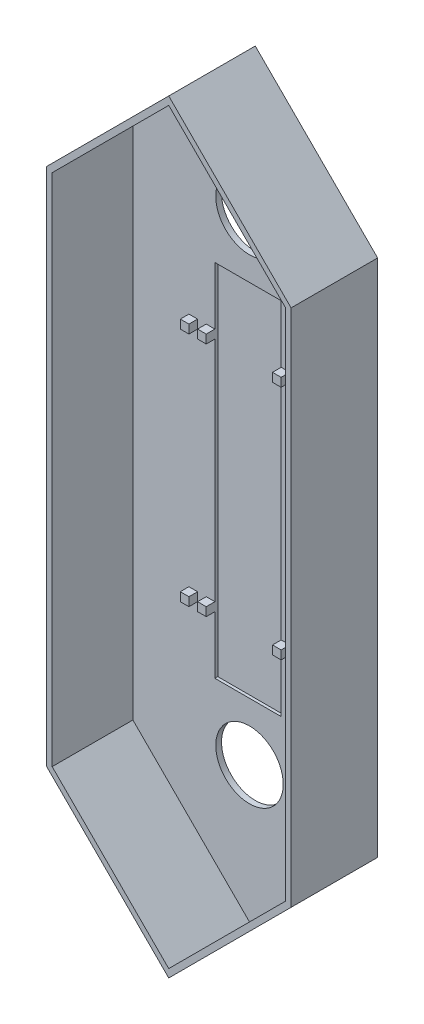
from build123d import *

# Parameters (mm, degrees)
EXTRUDE_3_DEPTH                 = 15
EXTRUDE_2_DEPTH                 = 1
SKETCH_4_R                      = 5.85
CUT_EXTRUDE_1_DEPTH             = 2
SKIZZE1_W                       = 11.487069154
SKIZZE1_H                       = 62.431572876
SCHNITT_LINEAR_AUSTRAGEN1_DEPTH = 0.5
SKIZZE2_W                       = 1.5
SKIZZE2_H                       = 1.5
AUFSATZ_LINEAR_AUSTRAGEN1_DEPTH = 1.5


with BuildPart() as part:
    # Эскиз1 → Вытянуть-Тонкостенный3 (new body)
    with BuildSketch(Plane.XY):
        Polygon((-21.213203436, -45), (-21.213203436, 45), (0, 66.213203436), (21.213203436, 45), (21.213203436, -45), (0, -66.213203436), align=None)
        Polygon((-20.213203436, -44.585786438), (-20.213203436, 44.585786438), (0, 64.798989873), (20.213203436, 44.585786438), (20.213203436, -44.585786438), (0, -64.798989873), align=None, mode=Mode.SUBTRACT)
    extrude(amount=EXTRUDE_3_DEPTH)

    # Эскиз2 → Бобышка-Вытянуть2 (add)
    with BuildSketch(Plane(origin=(0, 0, 0), x_dir=(-1, 0, 0), z_dir=(0, 0, -1))):
        Polygon((-20.213203436, -44.585786438), (0, -64.798989873), (20.213203436, -44.585786438), (20.213203436, 44.585786438), (0, 64.798989873), (-20.213203436, 44.585786438), align=None)
    extrude(amount=-EXTRUDE_2_DEPTH)

    # Эскиз4 → Вырез-Вытянуть1 (cut)
    with BuildSketch(Plane.XY.offset(1)):
        with Locations((0, 41.215786438)):
            Circle(SKETCH_4_R)
        with Locations((0, -41.215786438)):
            Circle(SKETCH_4_R)
    extrude(amount=-CUT_EXTRUDE_1_DEPTH, mode=Mode.SUBTRACT)

    # Skizze1 → Schnitt-Linear austragen1 (cut)
    with BuildSketch(Plane.XY.offset(1)):
        with Locations((-0.256465423, 0)):
            Rectangle(SKIZZE1_W, SKIZZE1_H)
    extrude(amount=-SCHNITT_LINEAR_AUSTRAGEN1_DEPTH, mode=Mode.SUBTRACT)

    # Skizze2 → Aufsatz-Linear austragen1 (add)
    with BuildSketch(Plane.XY.offset(1)):
        with Locations((6.237069154, 20.465786438)):
            Rectangle(SKIZZE2_W, SKIZZE2_H)
        with Locations((9.237069154, 20.465786438)):
            Rectangle(SKIZZE2_W, SKIZZE2_H)
        with Locations((-6.75, 20.465786438)):
            Rectangle(SKIZZE2_W, SKIZZE2_H)
        with Locations((-9.75, 20.465786438)):
            Rectangle(SKIZZE2_W, SKIZZE2_H)
        with Locations((6.237069154, -20.465786438)):
            Rectangle(SKIZZE2_W, SKIZZE2_H)
        with Locations((9.237069154, -20.465786438)):
            Rectangle(SKIZZE2_W, SKIZZE2_H)
        with Locations((-6.75, -20.465786438)):
            Rectangle(SKIZZE2_W, SKIZZE2_H)
        with Locations((-9.75, -20.465786438)):
            Rectangle(SKIZZE2_W, SKIZZE2_H)
    extrude(amount=AUFSATZ_LINEAR_AUSTRAGEN1_DEPTH)


solid = part.part
